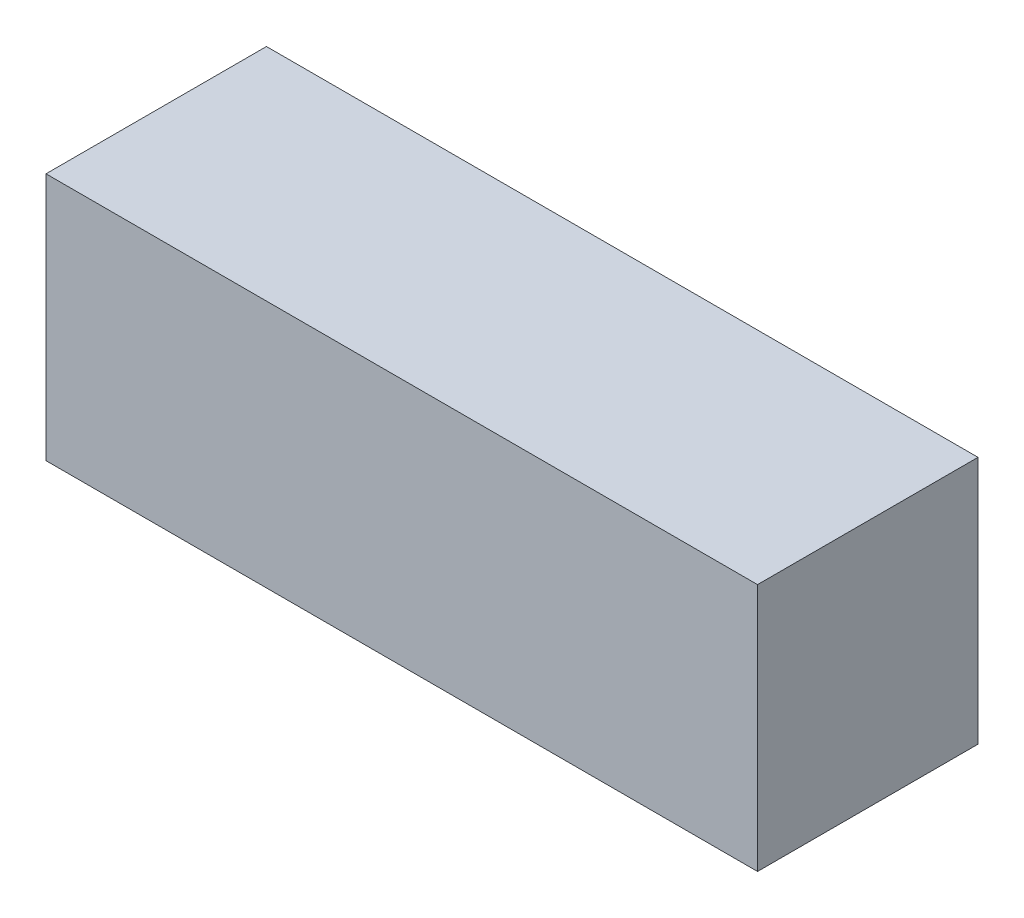
from build123d import *

# Parameters (mm, degrees)
SKETCH2_W           = 154.94
SKETCH2_H           = 48.006
BOSS_EXTRUDE1_DEPTH = 54.102


with BuildPart() as part:
    # Sketch2 → Boss-Extrude1 (new body)
    with BuildSketch(Plane(origin=(0, 0, 0), x_dir=(1, 0, 0), z_dir=(0, 1, 0))):
        with Locations((77.47, 24.003)):
            Rectangle(SKETCH2_W, SKETCH2_H)
    extrude(amount=BOSS_EXTRUDE1_DEPTH)


solid = part.part
